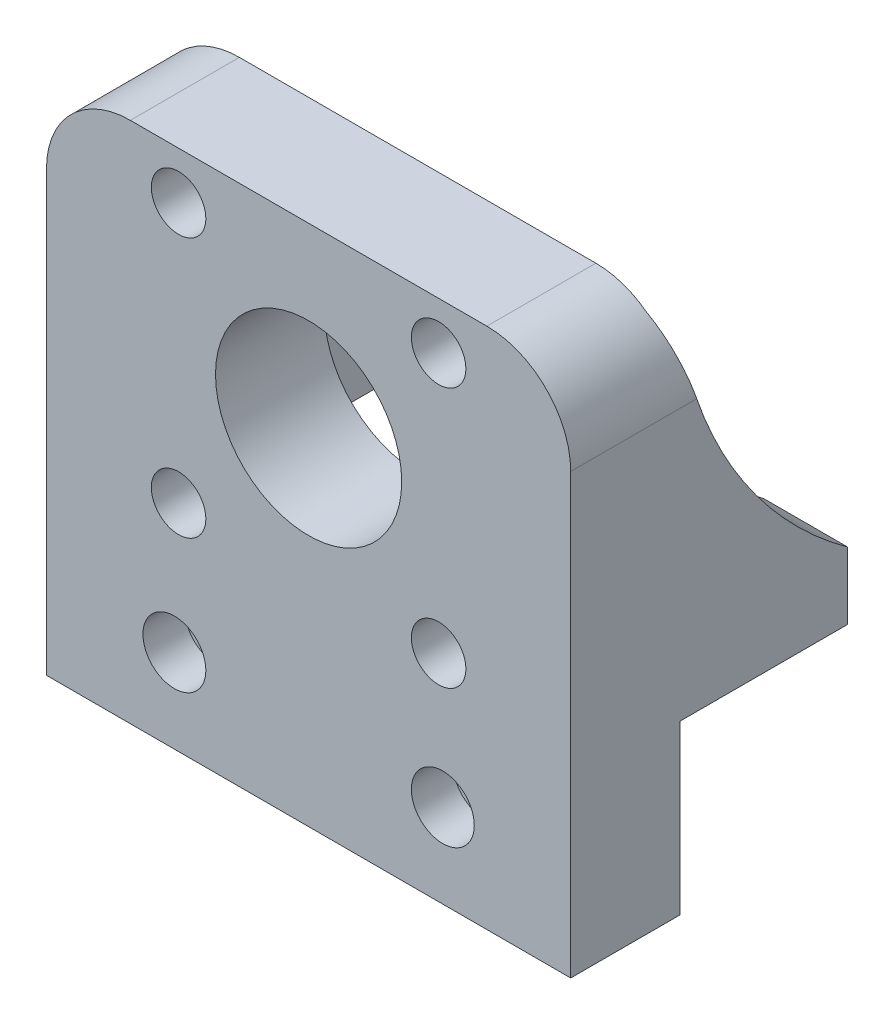
from build123d import *

# Parameters (mm, degrees)
CROQUIS1_W                 = 62.5
CROQUIS1_H                 = 62.3
CROQUIS1_R                 = 11.1
CROQUIS1_R_2               = 1.55
CROQUIS1_R_3               = 2.05
SALIENTE_EXTRUIR1_DEPTH    = 13
CROQUIS2_R                 = 3.25
CROQUIS2_R_2               = 3.75
CORTAR_EXTRUIR1_DEPTH      = 5
SALIENTE_EXTRUIR2_DEPTH    = 10
SALIENTE_EXTRUIR3_START    = -10
SALIENTE_EXTRUIR3_DEPTH    = 10
CORTAR_EXTRUIR2_REACH      = 167.502
CORTAR_EXTRUIR2_END_RADIUS = 50
CROQUIS6_R                 = 2.05
CORTAR_EXTRUIR3_REACH      = 177.502
CORTAR_EXTRUIR3_END_RADIUS = 50
CORTAR_EXTRUIR3_START      = -10
CROQUIS7_R                 = 3.75
REDONDEO1_R                = 10


with BuildPart() as part:
    # Croquis1 → Saliente-Extruir1 (new body)
    with BuildSketch(Plane.XY):
        with Locations((127.5, 21.15)):
            Rectangle(CROQUIS1_W, CROQUIS1_H)
        with Locations(Location((127.5, 31.15, 0), (0, 0, 180))):
            Circle(CROQUIS1_R, mode=Mode.SUBTRACT)
        with Locations(Location((112, 46.65, 0), (0, 0, 180))):
            Circle(CROQUIS1_R_2, mode=Mode.SUBTRACT)
        with Locations(Location((143, 46.65, 0), (0, 0, 180))):
            Circle(CROQUIS1_R_2, mode=Mode.SUBTRACT)
        with Locations(Location((143, 15.65, 0), (0, 0, 180))):
            Circle(CROQUIS1_R_2, mode=Mode.SUBTRACT)
        with Locations(Location((112, 15.65, 0), (0, 0, 180))):
            Circle(CROQUIS1_R_2, mode=Mode.SUBTRACT)
        with Locations(Location((111.5, 0, 0), (0, 0, 180))):
            Circle(CROQUIS1_R_3, mode=Mode.SUBTRACT)
        with Locations(Location((143.5, 0, 0), (0, 0, 180))):
            Circle(CROQUIS1_R_3, mode=Mode.SUBTRACT)
    extrude(amount=SALIENTE_EXTRUIR1_DEPTH)

    # Croquis2 → Cortar-Extruir1 (cut)
    with BuildSketch(Plane.XY.offset(13)):
        with Locations((112, 46.65)):
            Circle(CROQUIS2_R)
        with Locations((143, 46.65)):
            Circle(CROQUIS2_R)
        with Locations((143, 15.65)):
            Circle(CROQUIS2_R)
        with Locations((112, 15.65)):
            Circle(CROQUIS2_R)
        with Locations((111.5, 0)):
            Circle(CROQUIS2_R_2)
        with Locations((143.5, 0)):
            Circle(CROQUIS2_R_2)
    extrude(amount=-CORTAR_EXTRUIR1_DEPTH, mode=Mode.SUBTRACT)

    # Croquis4 → Saliente-Extruir2 (add)
    with BuildSketch(Plane(origin=(158.75, 0, 0), x_dir=(0, 0, -1), z_dir=(1, 0, 0))):
        with BuildLine():
            Line((0, 10), (20, 10))
            Line((20, 10), (20, 18))
            ThreePointArc((20, 18), (6.81438238, 32.17234388), (0, 50.290843704))
            Line((0, 50.290843704), (0, 10))
        make_face()
    extrude(amount=-SALIENTE_EXTRUIR2_DEPTH)

    # Croquis5 → Saliente-Extruir3 (add)
    with BuildSketch(Plane.ZY.offset(-96.25).offset(SALIENTE_EXTRUIR3_START)):
        with BuildLine():
            Line((0, 10), (0, 50.290843704))
            ThreePointArc((0, 50.290843704), (-6.81438238, 32.17234388), (-20, 18))
            Line((-20, 18), (-20, 10))
            Line((-20, 10), (0, 10))
        make_face()
    extrude(amount=SALIENTE_EXTRUIR3_DEPTH)

    # Cortar-Extruir2: up to this cylinder (the profile starts outside it)
    cortar_extruir2_end = Plane(origin=(127.5, 58.5, -49.321493823), z_dir=(1, 0, 0)) * Cylinder(CORTAR_EXTRUIR2_END_RADIUS, 488.504, mode=Mode.PRIVATE)
    # Croquis6 → Cortar-Extruir2 (cut, up to the surface)
    with BuildSketch(Plane.XZ.offset(-10), mode=Mode.PRIVATE) as cortar_extruir2_sk1:
        with Locations((101.25, -10)):
            Circle(CROQUIS6_R)
    cortar_extruir2_tool1 = extrude(cortar_extruir2_sk1.sketch, amount=-CORTAR_EXTRUIR2_REACH, mode=Mode.PRIVATE) - cortar_extruir2_end
    add(cortar_extruir2_tool1.solids().sort_by_distance((101.25, 10, -10))[0], mode=Mode.SUBTRACT)
    # Croquis6 → Cortar-Extruir2 (cut, up to the surface)
    with BuildSketch(Plane.XZ.offset(-10), mode=Mode.PRIVATE) as cortar_extruir2_sk2:
        with Locations((153.75, -10)):
            Circle(CROQUIS6_R)
    cortar_extruir2_tool2 = extrude(cortar_extruir2_sk2.sketch, amount=-CORTAR_EXTRUIR2_REACH, mode=Mode.PRIVATE) - cortar_extruir2_end
    add(cortar_extruir2_tool2.solids().sort_by_distance((153.75, 10, -10))[0], mode=Mode.SUBTRACT)

    # Cortar-Extruir3: up to this cylinder (the profile starts outside it)
    cortar_extruir3_end = Plane(origin=(127.5, 58.5, -49.321493823), z_dir=(1, 0, 0)) * Cylinder(CORTAR_EXTRUIR3_END_RADIUS, 508.504, mode=Mode.PRIVATE)
    # Croquis7 → Cortar-Extruir3 (cut, up to the surface)
    with BuildSketch(Plane.XZ.offset(-10).offset(CORTAR_EXTRUIR3_START), mode=Mode.PRIVATE) as cortar_extruir3_sk1:
        with Locations((101.25, -10)):
            Circle(CROQUIS7_R)
    cortar_extruir3_tool1 = extrude(cortar_extruir3_sk1.sketch, amount=-CORTAR_EXTRUIR3_REACH, mode=Mode.PRIVATE) - cortar_extruir3_end
    add(cortar_extruir3_tool1.solids().sort_by_distance((101.25, 20, -10))[0], mode=Mode.SUBTRACT)
    # Croquis7 → Cortar-Extruir3 (cut, up to the surface)
    with BuildSketch(Plane.XZ.offset(-10).offset(CORTAR_EXTRUIR3_START), mode=Mode.PRIVATE) as cortar_extruir3_sk2:
        with Locations((153.75, -10)):
            Circle(CROQUIS7_R)
    cortar_extruir3_tool2 = extrude(cortar_extruir3_sk2.sketch, amount=-CORTAR_EXTRUIR3_REACH, mode=Mode.PRIVATE) - cortar_extruir3_end
    add(cortar_extruir3_tool2.solids().sort_by_distance((153.75, 20, -10))[0], mode=Mode.SUBTRACT)

    # Redondeo1
    redondeo1_edges = [part.edges().sort_by_distance(p)[0] for p in [
        (96.25, 52.3, 6.5),
        (158.75, 52.3, 6.5),
    ]]
    fillet(redondeo1_edges, radius=REDONDEO1_R)


solid = part.part
